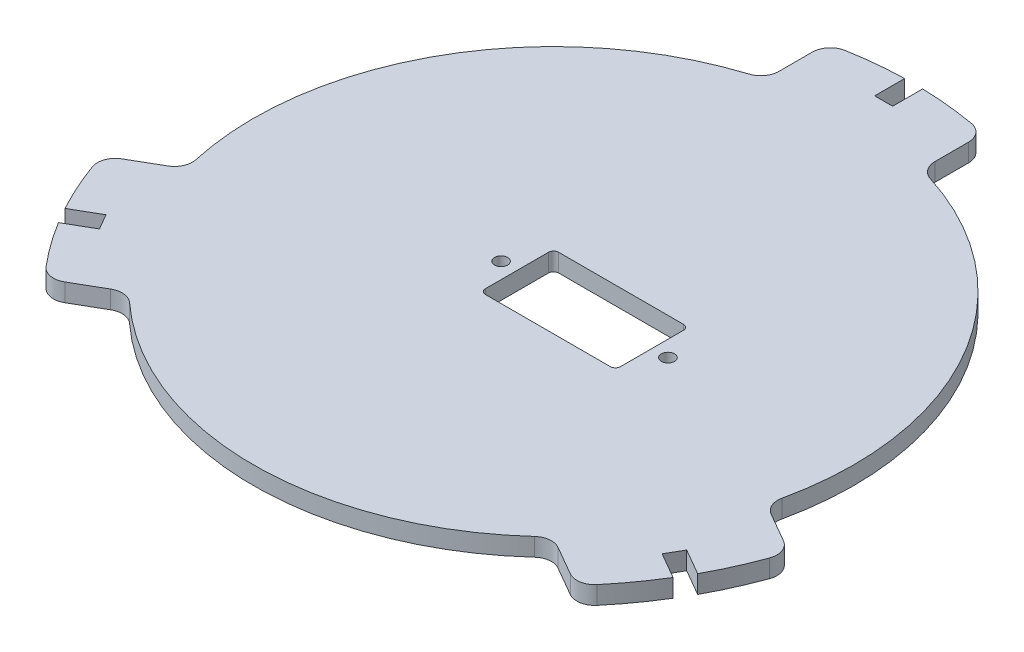
from build123d import *

# Parameters (mm, degrees)
SKETCH1_R           = 60
SKETCH1_R_2         = 1.1
BOSS_EXTRUDE1_DEPTH = 3
SKETCH2_W           = 5.018752931
SKETCH2_H           = 3
CUT_EXTRUDE1_DEPTH  = 1.5
CIRPATTERN1_COUNT   = 3
CUT_EXTRUDE2_REACH  = 91.692
FILLET1_R           = 3


with BuildPart() as part:
    # Sketch1 → Boss-Extrude1 (new body)
    with BuildSketch(Plane(origin=(0, 63.433902084, 0), x_dir=(1, 0, 0), z_dir=(0, 1, 0))):
        with Locations(Location((0, 6.619681527, 0), (0, 0, 270))):
            Circle(SKETCH1_R)
        with Locations(Location((-8.75, 6.619681527, 0), (0, 0, 270))):
            Circle(SKETCH1_R_2, mode=Mode.SUBTRACT)
        with Locations(Location((19.05, 6.619681527, 0), (0, 0, 270))):
            Circle(SKETCH1_R_2, mode=Mode.SUBTRACT)
        with BuildLine():
            Line((1.562049935, 12.719681527), (0, 12.719681527))
            Line((0, 12.719681527), (-1.562049935, 12.719681527))
            Line((-1.562049935, 12.719681527), (-5.25, 12.719681527))
            ThreePointArc((-5.25, 12.719681527), (-5.851040764, 12.470722291), (-6.1, 11.869681527))
            Line((-6.1, 11.869681527), (-6.1, 8.181731462))
            Line((-6.1, 8.181731462), (-6.1, 6.619681527))
            Line((-6.1, 6.619681527), (-6.1, 5.057631592))
            Line((-6.1, 5.057631592), (-6.1, 1.369681527))
            ThreePointArc((-6.1, 1.369681527), (-5.851040764, 0.768640763), (-5.25, 0.519681527))
            Line((-5.25, 0.519681527), (-1.562049935, 0.519681527))
            Line((-1.562049935, 0.519681527), (0, 0.519681527))
            Line((0, 0.519681527), (1.562049935, 0.519681527))
            Line((1.562049935, 0.519681527), (15.55, 0.519681527))
            ThreePointArc((15.55, 0.519681527), (16.151040764, 0.768640763), (16.4, 1.369681527))
            Line((16.4, 1.369681527), (16.4, 11.869681527))
            ThreePointArc((16.4, 11.869681527), (16.151040764, 12.470722291), (15.55, 12.719681527))
            Line((15.55, 12.719681527), (1.562049935, 12.719681527))
        make_face(mode=Mode.SUBTRACT)
    extrude(amount=BOSS_EXTRUDE1_DEPTH)

    # Sketch2 → Cut-Extrude1 (cut, symmetric)
    with BuildSketch(Plane(origin=(0, 0, 0), x_dir=(0, 0, -1), z_dir=(1, 0, 0))):
        with Locations((64.110305062, 64.933902084)):
            Rectangle(SKETCH2_W, SKETCH2_H)
    cut_extrude1 = extrude(amount=CUT_EXTRUDE1_DEPTH, both=True, mode=Mode.SUBTRACT)

    # CirPattern1: Cut-Extrude1 ×3 about axis
    cirpattern1_axis = Axis((0, 0, -6.619681527), (0, 1, 0))
    for i in range(1, CIRPATTERN1_COUNT):
        add(cut_extrude1.rotate(cirpattern1_axis, i * 360 / CIRPATTERN1_COUNT), mode=Mode.SUBTRACT)

    # Sketch3 → Cut-Extrude2 (cut, up to next)
    with BuildSketch(Plane(origin=(0, 66.433902084, 0), x_dir=(1, 0, 0), z_dir=(0, 1, 0)), mode=Mode.PRIVATE) as cut_extrude2_sk1:
        with BuildLine():
            Line((35.312079594, -28.778864132), (44.227211632, -33.926018014))
            ThreePointArc((44.227211632, -33.926018014), (0, -53.380318473), (-44.227211632, -33.926018014))
            Line((-44.227211632, -33.926018014), (-35.312079594, -28.778864132))
            ThreePointArc((-35.312079594, -28.778864132), (0, -43.380318473), (35.312079594, -28.778864132))
        make_face()
    cut_extrude2_tool1 = extrude(cut_extrude2_sk1.sketch, amount=-CUT_EXTRUDE2_REACH, mode=Mode.PRIVATE) & part.part
    # Sketch3 → Cut-Extrude2 (cut, up to next)
    with BuildSketch(Plane(origin=(0, 66.433902084, 0), x_dir=(1, 0, 0), z_dir=(0, 1, 0)), mode=Mode.PRIVATE) as cut_extrude2_sk2:
        with BuildLine():
            Line((48.312079594, -6.262203633), (57.227211632, -11.409357515))
            ThreePointArc((57.227211632, -11.409357515), (51.961524227, 36.619681527), (13, 65.194420109))
            Line((13, 65.194420109), (13, 54.900112345))
            ThreePointArc((13, 54.900112345), (43.301270189, 31.619681527), (48.312079594, -6.262203633))
        make_face()
    cut_extrude2_tool2 = extrude(cut_extrude2_sk2.sketch, amount=-CUT_EXTRUDE2_REACH, mode=Mode.PRIVATE) & part.part
    # Sketch3 → Cut-Extrude2 (cut, up to next)
    with BuildSketch(Plane(origin=(0, 66.433902084, 0), x_dir=(1, 0, 0), z_dir=(0, 1, 0)), mode=Mode.PRIVATE) as cut_extrude2_sk3:
        with BuildLine():
            Line((-48.312079594, -6.262203633), (-57.227211632, -11.409357515))
            ThreePointArc((-57.227211632, -11.409357515), (-51.961524227, 36.619681527), (-13, 65.194420109))
            Line((-13, 65.194420109), (-13, 54.900112345))
            ThreePointArc((-13, 54.900112345), (-43.301270189, 31.619681527), (-48.312079594, -6.262203633))
        make_face()
    cut_extrude2_tool3 = extrude(cut_extrude2_sk3.sketch, amount=-CUT_EXTRUDE2_REACH, mode=Mode.PRIVATE) & part.part
    add(cut_extrude2_tool1.solids().sort_by_distance((0, 66.433902, 52.4622))[0], mode=Mode.SUBTRACT)
    add(cut_extrude2_tool2.solids().sort_by_distance((53.21901, 66.433902, 8.057458))[0], mode=Mode.SUBTRACT)
    add(cut_extrude2_tool3.solids().sort_by_distance((-13.898729, 66.433902, -60.047266))[0], mode=Mode.SUBTRACT)

    # Fillet1
    fillet1_edges = [part.edges().sort_by_distance(p)[0] for p in [
        (-13, 64.933902084, -54.900112345),
        (-48.312079594, 64.933902084, 6.262203633),
        (-57.227211632, 64.933902084, 11.409357515),
        (-13, 64.933902084, -65.194420109),
        (-35.312079594, 64.933902084, 28.778864132),
        (35.312079594, 64.933902084, 28.778864132),
        (44.227211632, 64.933902084, 33.926018014),
        (-44.227211632, 64.933902084, 33.926018014),
        (48.312079594, 64.933902084, 6.262203633),
        (13, 64.933902084, -54.900112345),
        (13, 64.933902084, -65.194420109),
        (57.227211632, 64.933902084, 11.409357515),
    ]]
    fillet(fillet1_edges, radius=FILLET1_R)


solid = part.part
